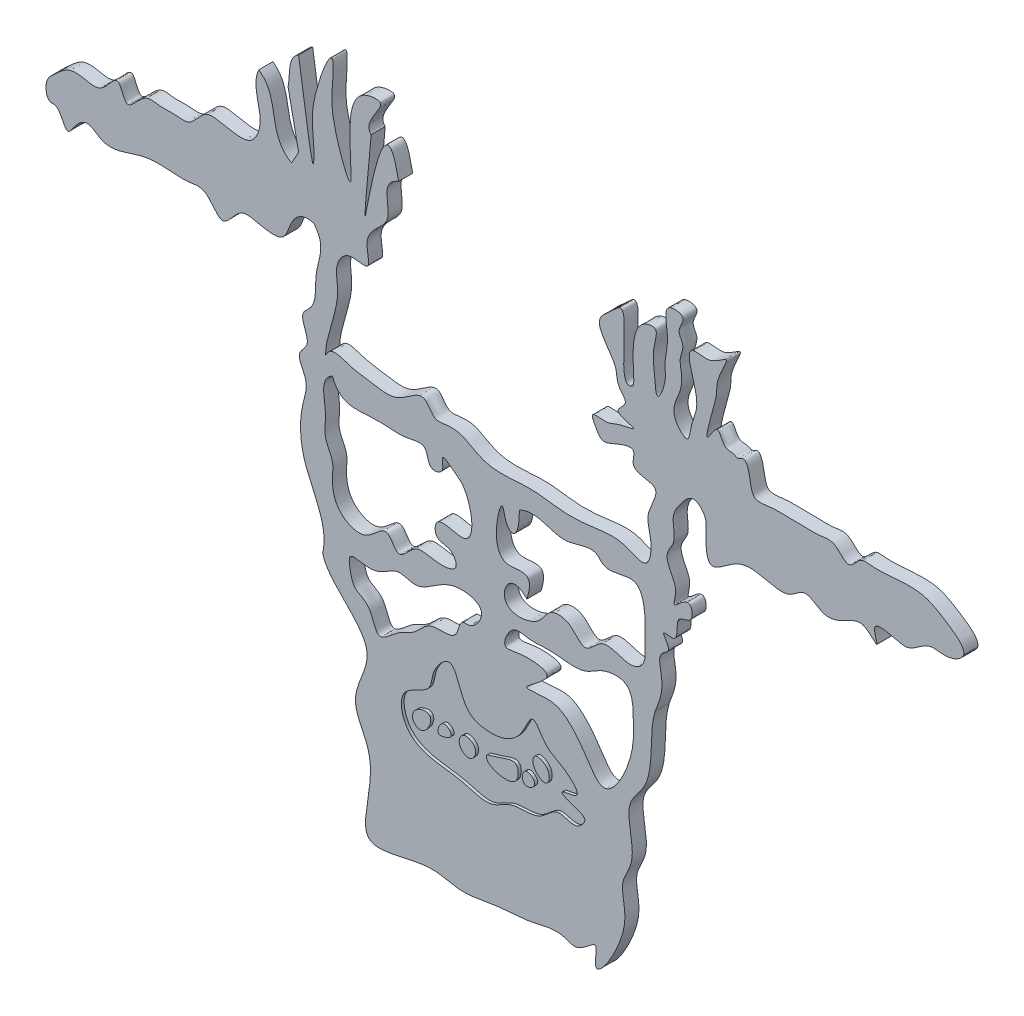
from build123d import *

# Parameters (mm, degrees)
BOSS_EXTRU_1_DEPTH           = 2.5
BOSS_EXTRU_1_DEPTH_BACK      = 2.5
ENL_V_MAT_EXTRU_1_DEPTH      = 1
ENL_V_MAT_EXTRU_1_DEPTH_BACK = 1
BOSS_EXTRU_2_START           = -5
BOSS_EXTRU_2_DEPTH           = 5.1
BOSS_EXTRU_2_2_DEPTH         = 5.1
BOSS_EXTRU_2_3_DEPTH         = 5.1
BOSS_EXTRU_2_4_DEPTH         = 5.1
BOSS_EXTRU_2_5_DEPTH         = 5.1
BOSS_EXTRU_2_6_DEPTH         = 5.1


with BuildPart() as part:
    # Esquisse5 → Boss.-Extru.1 (new, two sides: drawn at the far end of the back side and taken through both)
    with BuildSketch(Plane.XY.offset(-BOSS_EXTRU_1_DEPTH_BACK)):
        with BuildLine():
            add(Edge.make_bspline(
                [(-109.344511659, 25.153395268), (-107.589254649, 29.421911051), (-101.339219595, 25.902929652), (-92.695552544, 25.314220124), (-83.46448962, 22.676252114), (-74.412996642, 33.275492549), (-71.274904721, 24.700650474), (-66.452941292, 25.333481683), (-60.820445495, 25.847182966), (-54.304488593, 20.502930821), (-45.153016179, 19.865306079), (-34.913101969, 21.206550113), (-24.021566002, 18.621998763), (-12.651602755, 20.170931924), (-3.866471795, 21.215630898), (5.364616437, 15.647679976), (7.119848324, 26.697353477), (3.217301344, 33.405226344), (11.779222196, 45.092953011), (-1.968971541, 43.599367897), (1.437557426, 52.096278646), (-6.019987537, 50.088991806), (-11.052796945, 46.823583059), (-13.405767436, 51.113244464), (-15.699295799, 55.645390129), (-8.916615346, 53.947845827), (-5.980193523, 56.388562404), (4.10796492, 57.51216439), (-8.750760516, 59.217405885), (-0.961983774, 63.846560735), (-6.064668992, 67.643002906), (-5.676761926, 73.309467573), (-9.571336368, 78.077252265), (-13.834516264, 85.158128626), (-8.507672521, 88.825856235), (0.450211474, 98.200422591), (-6.965143511, 65.105364995), (0, 70.636018)],
                knots=[0, 0, 0, 0, 0.038715947, 0.066818348, 0.10588863, 0.146716867, 0.169739251, 0.177878893, 0.200669891, 0.234895126, 0.269428703, 0.305280107, 0.355981649, 0.398432828, 0.437537011, 0.464385494, 0.493232459, 0.529194573, 0.564336717, 0.596403188, 0.612682472, 0.632285326, 0.657557571, 0.673836855, 0.684132778, 0.703735632, 0.721045052, 0.742876924, 0.766185312, 0.78379405, 0.800554599, 0.820690961, 0.846940518, 0.873240506, 0.900963128, 0.913677655, 1, 1, 1, 1], degree=3))
            add(Edge.make_bspline(
                [(0, 70.636018), (0.805278353, 74.133831027), (-3.107450165, 91.518619561), (8.999346732, 92.505976238), (6.429898138, 84.358492656), (7.423975469, 80.33225472), (8.047696894, 68.486069297), (11.93858664, 77.708465744), (10.624327057, 83.920889427), (13.29432721, 91.236631904), (9.694077884, 102.364063289), (19.693091186, 100.976923321), (14.852165034, 95.702541646), (18.556549684, 91.733970901), (15.987726932, 87.363671228), (17.379094774, 82.557729252), (16.919550407, 75.862474876), (11.973387385, 69.60348445), (19.599849553, 61.660448674), (20.550098448, 70.678139802), (25.142121191, 76.975381446), (16.828251117, 92.381116223), (24.21426829, 92.082856929), (27.829551161, 91.182942151), (35.821054195, 98.230249078), (29.327432761, 88.125694168), (29.736434139, 82.411949115), (28.159368987, 77.404069448), (24.30367085, 62.947282181), (30.248138499, 74.915772772), (31.480824806, 68.575348807), (33.908397317, 67.391513918), (35.493450325, 67.749272121), (37.063599096, 66.387557293), (39.862305143, 69.019204089), (41.649690428, 62.398254073), (42.104131559, 56.237417085), (49.688197455, 58.008481319), (55.474079484, 57.437235744), (61.145043283, 57.694893692), (66.202600348, 57.337373933), (71.720457182, 59.093143593), (76.504564451, 50.820023685), (80.002047639, 58.06603763), (85.292941894, 57.307788307), (92.159539484, 57.557826638), (102.159758833, 58.777982772), (110.318718464, 54.217649231), (120.723019561, 47.020505934), (111.49153862, 41.878814117), (104.406812701, 44.603087065), (98.824803059, 37.906772926), (92.588714261, 39.26305939), (83.492400754, 41.67245803), (88.179812212, 31.367081894), (82.205743571, 38.915082929), (75.77616626, 36.65390107), (68.620618416, 31.604980211), (61.085256324, 39.393731836), (55.350460652, 32.684114008), (46.655915712, 34.489461218), (37.269088825, 36.887116093), (25.959282015, 24.617169038), (25.555414021, 37.329677127), (26.158045408, 43.180184066), (21.146621221, 48.057671533), (16.562027313, 42.601143935), (12.914768993, 37.099591197), (15.681239193, 30.051306943), (10.493520534, 24.535983476), (13.902430182, 18.951870966), (15.494449493, 14.848995948), (13.221286291, 7.817015965), (20.25002737, 16.854659461), (21.74484938, 7.330408273), (13.653478554, 8.32061916), (17.166253744, -1.609178359), (8.537056537, 1.233931252), (14.230464742, -4.47792894), (8.0837126, -7.0097751), (11.342317074, -16.176738627), (9.40657662, -21.600619943), (7.719657181, -25.69170208)],
                knots=[0, 0, 0, 0, 0.04512477, 0.049215334, 0.059032686, 0.077849279, 0.08959095, 0.101354273, 0.112840454, 0.130913155, 0.149078205, 0.15742135, 0.167540846, 0.174530804, 0.184483575, 0.192705506, 0.203372391, 0.223277932, 0.234284513, 0.242045812, 0.262102092, 0.290782748, 0.294055199, 0.302236326, 0.314315616, 0.330881136, 0.339103067, 0.350018052, 0.368971396, 0.378972163, 0.388474235, 0.390274787, 0.394744547, 0.397176959, 0.40095589, 0.411146586, 0.422652664, 0.434106242, 0.447196046, 0.459467737, 0.466830751, 0.477466216, 0.490401714, 0.502673405, 0.506763969, 0.520671885, 0.544397154, 0.561596989, 0.581299752, 0.593787701, 0.606877504, 0.623723476, 0.633574858, 0.647506816, 0.656653594, 0.66778113, 0.676003061, 0.696455879, 0.711496698, 0.722862283, 0.738406425, 0.759677356, 0.780901035, 0.799194592, 0.808230942, 0.818403335, 0.829190633, 0.841996123, 0.857540264, 0.866687043, 0.881184037, 0.888726664, 0.896134989, 0.907500575, 0.916647353, 0.925794131, 0.939899163, 0.946444065, 0.955636463, 0.961421394, 0.976170131, 1, 1, 1, 1], degree=3))
            add(Edge.make_bspline(
                [(7.719657181, -25.69170208), (5.860032138, -31.69384322), (7.080951882, -40.496405286), (4.106474287, -51.814433702), (-2.522861177, -57.97612198), (-0.921343648, -67.654446459), (0.340462906, -76.191049709), (-6.045232839, -85.947966736), (1.412338563, -96.208246256), (-15.655520027, -122.942088627), (-12.034068325, -104.623657721), (-19.237214543, -113.838420046), (-26.978302304, -109.481218495), (-35.998502741, -113.12173714), (-48.753037264, -113.068431299), (-60.380289889, -116.539272865), (-75.231159691, -111.422716989), (-96.82300832, -122.283473286), (-94.071317906, -101.530103463), (-91.86865944, -89.112488967), (-102.259421439, -74.620042773), (-86.758954073, -54.760298752), (-108.135680998, -44.578286089), (-110.355785067, -36.085667067)],
                knots=[0, 0, 0, 0, 0.06920362, 0.098548886, 0.128834178, 0.163223612, 0.200739359, 0.224548643, 0.282385419, 0.351323971, 0.371645, 0.400340732, 0.416281859, 0.46496608, 0.499497327, 0.562335425, 0.592403333, 0.681558062, 0.715947496, 0.784726365, 0.829733318, 0.894183896, 1, 1, 1, 1], degree=3))
            add(Edge.make_bspline(
                [(-110.355785067, -36.085667067), (-108.042293123, -26.360063991), (-118.326558085, -14.272605293), (-118.714425814, 3.66313205), (-114.860463566, 14.232484722), (-120.557913386, 20.862442365), (-113.3368001, 26.081796862), (-119.715204471, 33.322468523), (-111.973330244, 38.731786935), (-114.327664092, 50.538790764), (-108.873342939, 58.304984298), (-113.502097654, 63.818945018)],
                knots=[0, 0, 0, 0, 0.256249372, 0.424787405, 0.4974419, 0.568528933, 0.611921815, 0.700995419, 0.73798122, 0.848138002, 1, 1, 1, 1], degree=3))
            add(Edge.make_bspline(
                [(-113.502097654, 63.818945018), (-117.216919888, 64.974160053), (-121.748065172, 61.665236127), (-123.719157006, 51.476400884), (-132.731242731, 54.005842644), (-140.659773876, 55.261859504), (-145.939869408, 43.799871326), (-151.186142271, 56.015698227), (-157.61954259, 54.079305538), (-164.313623573, 54.337676903), (-172.456034576, 55.228155827), (-180.830885545, 51.617026849), (-188.498853616, 50.497174688), (-193.47625054, 55.536732812), (-197.997266421, 52.398763213), (-201.639988115, 45.173141483), (-203.377944906, 54.667104022), (-208.498005036, 53.929016864), (-209.28437311, 60.586477493), (-204.94376512, 64.079614419), (-200.835383527, 68.139512695), (-194.823566254, 67.694411052), (-188.39932055, 65.501258016), (-182.827030504, 76.736586869), (-180.076851833, 63.075179343), (-174.283673763, 74.188787303), (-167.784138476, 72.12556278), (-163.063980401, 72.85376943), (-156.392991236, 71.545988081), (-153.182052561, 79.315606266), (-144.520461557, 78.157439268), (-135.507868967, 75.465748345), (-130.464285347, 88.42193884), (-135.765529528, 95.148428863), (-133.042751829, 101.23721897)],
                knots=[0, 0, 0, 0, 0.042215846, 0.0715411, 0.118379145, 0.137114363, 0.1783744, 0.218206019, 0.244435324, 0.259423498, 0.310008586, 0.350926919, 0.382776789, 0.407912721, 0.429761552, 0.449677362, 0.484223396, 0.48797044, 0.515249329, 0.536610763, 0.566233744, 0.586842483, 0.61494531, 0.650934488, 0.676962284, 0.715947747, 0.738430008, 0.762785791, 0.781521009, 0.822781046, 0.843389785, 0.893974873, 0.924987177, 1, 1, 1, 1], degree=3))
            add(Edge.make_bspline(
                [(-133.042751829, 101.23721897), (-124.997894036, 95.609485937), (-130.542559368, 83.862724923), (-121.401511044, 78.370495999)],
                knots=[0, 0, 0, 0, 1, 1, 1, 1], degree=3))
            Line((-121.401511044, 78.370495999), (-118.906959447, 82.943840593))
            Line((-118.906959447, 82.943840593), (-122.648786842, 101.23721897))
            add(Edge.make_bspline(
                [(-118.906959447, 112.878459755), (-123.089001942, 110.369112423), (-121.742081518, 105.17006777), (-122.648786842, 101.23721897)],
                knots=[0, 0, 0, 0, 1, 1, 1, 1], degree=3))
            add(Edge.make_bspline(
                [(-118.906959447, 112.878459755), (-117.987046534, 108.864393082), (-113.417892248, 71.51089919), (-113.45093178, 91.338067865), (-115.671361183, 99.265896618), (-105.94631718, 124.811600551), (-106.900478172, 108.607284024), (-107.748689985, 99.377424054), (-97.836147782, 72.122907261), (-102.352170363, 100.972747778), (-98.231217436, 112.857815769), (-85.492652151, 113.502088933), (-96.578313927, 104.414511034), (-93.12992628, 101.23721897)],
                knots=[0, 0, 0, 0, 0.203681945, 0.231518554, 0.326163025, 0.443506797, 0.493612694, 0.552069573, 0.681472385, 0.803953465, 0.895136951, 0.917406239, 1, 1, 1, 1], degree=3))
            add(Edge.make_bspline(
                [(-93.12992628, 101.23721897), (-99.727046417, 29.646897087), (-90.513740123, 130.523044076), (-83.377237133, 91.741906078)],
                knots=[0, 0, 0, 0, 1, 1, 1, 1], degree=3))
            add(Edge.make_bspline(
                [(-83.377237133, 91.741906078), (-90.448707401, 89.033229159), (-82.145183217, 76.719013031), (-97.431119268, 71.278493512), (-92.061494489, 57.954654831), (-101.97590079, 61.839432085), (-106.26095686, 54.701365469), (-103.356986924, 42.618252852), (-109.290101236, 32.775190883), (-109.344511659, 25.153395268)],
                knots=[0, 0, 0, 0, 0.182686469, 0.350002825, 0.446213418, 0.524077948, 0.620688407, 0.695610259, 1, 1, 1, 1], degree=3))
        make_face()
        with BuildLine():
            add(Edge.make_bspline(
                [(-60.284996922, -22.658843671), (-57.679623036, -22.792823807), (-51.01424169, -24.694812643), (-56.521322114, -32.868158212), (-61.895337536, -31.940577147), (-62.02146133, -40.685562755), (-72.483746322, -37.086251409), (-77.168246521, -44.712504934), (-83.869496053, -46.348051791), (-91.474395334, -55.158490288), (-92.739744826, -43.492947687), (-99.51793155, -41.638568616), (-100.50397494, -36.88423617), (-101.550662107, -30.534858217), (-93.304949934, -33.435915706), (-88.39295956, -30.87212657), (-83.103943407, -27.526114356), (-76.652699656, -30.773754759), (-69.425165146, -24.957803693), (-64.053961827, -22.46502641), (-60.284996922, -22.658843671)],
                knots=[0, 0, 0, 0, 0.05860203, 0.128869378, 0.13940948, 0.186334695, 0.264119349, 0.327318135, 0.383462883, 0.450038592, 0.522701203, 0.565587317, 0.610698648, 0.642318954, 0.693500435, 0.757509471, 0.792112126, 0.841798644, 0.915225605, 1, 1, 1, 1], degree=3))
        make_face(mode=Mode.SUBTRACT)
        with BuildLine():
            add(Edge.make_bspline(
                [(-45.317687342, -32.343839672), (-46.54173064, -31.33391442), (-43.50546744, -24.106038911), (-36.48795409, -26.395680664), (-28.325720353, -24.920709339), (-18.331207252, -27.681729989), (-11.155234007, -21.696393611), (-0.218090155, -20.691342992), (0.023089394, -33.811646473), (0.250723748, -44.398951812), (-9.488304087, -63.953624722), (-17.298698285, -50.578847149), (-22.361645481, -44.295936677), (-28.897297122, -39.836964754), (-43.458060966, -43.227354147), (-24.101037263, -32.293001082), (-38.966002727, -31.32880479), (-44.686552491, -32.864572087), (-45.317687342, -32.343839672)],
                knots=[0, 0, 0, 0, 0.049950649, 0.081412473, 0.13861579, 0.224420765, 0.269572765, 0.329636248, 0.3984377, 0.47882395, 0.598799949, 0.659914582, 0.726618469, 0.773962638, 0.831165954, 0.898517798, 0.974244706, 1, 1, 1, 1], degree=3))
        make_face(mode=Mode.SUBTRACT)
        with BuildLine():
            add(Edge.make_bspline(
                [(-106.849960063, 20.164292074), (-104.4176376, 13.083024939), (-96.663714679, 14.445390232), (-87.075727019, 14.469465298), (-81.105270565, 13.673671294), (-72.792079958, 16.708316694), (-73.195335632, 8.218727754), (-64.499139676, 10.403170961), (-71.145847235, 18.672015819), (-61.94803132, 11.017602886)],
                knots=[0, 0, 0, 0, 0.29295692, 0.41008258, 0.535016616, 0.659950653, 0.764711027, 0.829986297, 1, 1, 1, 1], degree=3))
            add(Edge.make_bspline(
                [(-61.94803132, 11.017602886), (-58.00948764, 8.515751679), (-53.228955717, -12.652695636), (-70.441520781, -2.747845616), (-70.671887797, -12.241399063), (-64.676859457, -11.30445429), (-61.26749811, -18.21182153), (-70.868512549, -19.205270279), (-77.591907708, -16.019487697), (-83.479554547, -25.95513285), (-87.621513939, -14.836311931), (-93.599093926, -24.003349654), (-100.951674973, -23.240865934), (-106.494860397, -18.418599398), (-107.12332934, -11.884172144), (-106.310964788, -5.454637161), (-110.3922844, -0.147625415), (-108.205650297, 9.2489794), (-111.87637407, 17.393607833), (-106.849960063, 20.164292074)],
                knots=[0, 0, 0, 0, 0.141144413, 0.214347354, 0.24617472, 0.287550295, 0.319672821, 0.374752262, 0.435224257, 0.489982127, 0.532801468, 0.596764739, 0.643129709, 0.691471568, 0.753000383, 0.784827749, 0.837727281, 0.890242435, 1, 1, 1, 1], degree=3))
        make_face(mode=Mode.SUBTRACT)
        with BuildLine():
            add(Edge.make_bspline(
                [(-37.834032551, -13.927913082), (-34.37077832, -3.013999217), (-45.44980997, -10.161057876), (-50.025710131, 0.026726855), (-46.605690254, 14.117852844), (-45.17878683, 2.980235903), (-40.494724718, 1.638182997), (-40.475695383, 12.108204048)],
                knots=[0, 0, 0, 0, 0.291807796, 0.452467098, 0.68092251, 0.763865725, 1, 1, 1, 1], degree=3))
            add(Edge.make_bspline(
                [(-40.475695383, 12.108204048), (-33.864389084, 15.400301842), (-26.44818834, 7.161777526), (-14.396399814, 14.572909383), (-9.766577735, 8.480621443), (-4.631433883, 10.550994115), (3.214257025, 11.014558921), (4.429735975, 0.983080079), (3.965250126, -6.470122581), (4.654603651, -13.382879079), (-2.543331551, -17.411606933), (-10.397698797, -10.5220015), (-17.3151872, -21.672354484), (-22.185238624, -12.699371365), (-30.370894003, -12.915408516), (-33.425703048, -20.945833936), (-50.379770922, -22.250174577), (-43.826459571, -7.823907389), (-37.834032551, -13.927913082)],
                knots=[0, 0, 0, 0, 0.130404059, 0.2124579, 0.225807884, 0.291886928, 0.310766655, 0.396954786, 0.445727415, 0.503147863, 0.528516734, 0.613998334, 0.668134851, 0.726665389, 0.773864706, 0.820642593, 0.908747986, 1, 1, 1, 1], degree=3))
        make_face(mode=Mode.SUBTRACT)
    extrude(amount=BOSS_EXTRU_1_DEPTH + BOSS_EXTRU_1_DEPTH_BACK)

    # Esquisse10 → Enlèv. mat.-Extru.1 (cut, two sides: drawn at the far end of the back side and taken through both)
    with BuildSketch(Plane.XY.offset(2.5).offset(-ENL_V_MAT_EXTRU_1_DEPTH_BACK)):
        with BuildLine():
            add(Edge.make_bspline(
                [(-65.540202069, -47.181767732), (-62.526796985, -47.071111185), (-61.52574011, -59.141409508), (-50.035726383, -62.48750703), (-40.117270713, -60.050430258), (-35.98622805, -46.66420919), (-30.851025415, -57.350925543), (-25.472405134, -57.990286094), (-16.759212756, -66.616073943), (-27.395934416, -66.286829993), (-21.563656228, -69.663767975), (-15.269988521, -70.268358789), (-20.667539453, -76.695651704), (-27.246819692, -71.81142614), (-33.305923924, -80.79365559), (-42.931221115, -78.280931835), (-50.931476969, -85.10579532), (-60.443106924, -81.07201438), (-70.479488589, -80.494448983), (-81.453706377, -77.157128652), (-84.260850793, -62.320698999), (-71.463667508, -60.658646864), (-71.708217877, -52.157077082), (-67.307492214, -47.246665156), (-65.540202069, -47.181767732)],
                knots=[0, 0, 0, 0, 0.074168918, 0.111192732, 0.189974926, 0.228193362, 0.264295277, 0.316050521, 0.351333977, 0.380168788, 0.395456162, 0.431495778, 0.454031447, 0.490319615, 0.533245886, 0.593544245, 0.633375005, 0.691239127, 0.744912668, 0.806538045, 0.866237151, 0.925634363, 0.9565017, 1, 1, 1, 1], degree=3))
        make_face()
    extrude(amount=ENL_V_MAT_EXTRU_1_DEPTH + ENL_V_MAT_EXTRU_1_DEPTH_BACK, mode=Mode.SUBTRACT)


with BuildPart() as body_2:
    # Esquisse11 → Boss.-Extru.2 (new body)
    with BuildSketch(Plane.XY.offset(2.5).offset(BOSS_EXTRU_2_START)):
        with BuildLine():
            add(Edge.make_bspline(
                [(-76.245326856, -66.969623898), (-77.802567924, -67.831028734), (-79.472356869, -70.822802051), (-74.177980324, -74.991654568), (-69.766564586, -65.910456933), (-74.852488101, -66.199159991), (-76.245326856, -66.969623898)],
                knots=[0, 0, 0, 0, 0.238984672, 0.42286315, 0.786245611, 1, 1, 1, 1], degree=3))
        make_face()
    extrude(amount=BOSS_EXTRU_2_DEPTH)


with BuildPart() as body_3:
    # Esquisse11 → Boss.-Extru.2 2 (new body)
    with BuildSketch(Plane.XY.offset(2.5).offset(BOSS_EXTRU_2_START)):
        with BuildLine():
            add(Edge.make_bspline(
                [(-67.268342332, -70.973237046), (-65.977321978, -70.65641324), (-63.196737709, -69.477868466), (-67.934125699, -64.913780505), (-70.320431364, -71.483139871), (-67.952058925, -71.141025023), (-67.268342332, -70.973237046)],
                knots=[0, 0, 0, 0, 0.253700463, 0.52358501, 0.865641765, 1, 1, 1, 1], degree=3))
        make_face()
    extrude(amount=BOSS_EXTRU_2_2_DEPTH)


with BuildPart() as body_4:
    # Esquisse11 → Boss.-Extru.2 3 (new body)
    with BuildSketch(Plane.XY.offset(2.5).offset(BOSS_EXTRU_2_START)):
        with BuildLine():
            add(Edge.make_bspline(
                [(-60.238166289, -66.969623898), (-61.04121235, -67.328429972), (-61.972053831, -68.890537635), (-61.532843882, -71.737173155), (-57.547786594, -74.456888085), (-54.508458701, -68.506563709), (-58.804015947, -66.328836429), (-60.238166289, -66.969623898)],
                knots=[0, 0, 0, 0, 0.150740819, 0.256618737, 0.486382243, 0.730793778, 1, 1, 1, 1], degree=3))
        make_face()
    extrude(amount=BOSS_EXTRU_2_3_DEPTH)


with BuildPart() as body_5:
    # Esquisse11 → Boss.-Extru.2 4 (new body)
    with BuildSketch(Plane.XY.offset(2.5).offset(BOSS_EXTRU_2_START)):
        with BuildLine():
            add(Edge.make_bspline(
                [(-52.078214522, -69.142857233), (-52.167254345, -69.619718107), (-51.751524987, -71.714253166), (-44.597732881, -73.837497751), (-40.609996902, -71.453739055), (-40.789610051, -64.034859442), (-46.705472605, -67.647106657), (-51.970973665, -68.688415671), (-52.070174083, -69.099795932), (-52.078214522, -69.142857233)],
                knots=[0, 0, 0, 0, 0.106461708, 0.312869244, 0.450857916, 0.59623707, 0.903863372, 0.990386337, 1, 1, 1, 1], degree=3))
        make_face()
    extrude(amount=BOSS_EXTRU_2_4_DEPTH)


with BuildPart() as body_6:
    # Esquisse11 → Boss.-Extru.2 5 (new body)
    with BuildSketch(Plane.XY.offset(2.5).offset(BOSS_EXTRU_2_START)):
        with BuildLine():
            add(Edge.make_bspline(
                [(-38.197614369, -66.969623898), (-39.393578854, -67.492563419), (-39.925213234, -71.726458777), (-36.024621604, -71.411744565), (-33.996702039, -68.608803811), (-37.046267933, -66.46619377), (-38.197614369, -66.969623898)],
                knots=[0, 0, 0, 0, 0.317087266, 0.525661912, 0.694742362, 1, 1, 1, 1], degree=3))
        make_face()
    extrude(amount=BOSS_EXTRU_2_5_DEPTH)


with BuildPart() as body_7:
    # Esquisse11 → Boss.-Extru.2 6 (new body)
    with BuildSketch(Plane.XY.offset(2.5).offset(BOSS_EXTRU_2_START)):
        with BuildLine():
            add(Edge.make_bspline(
                [(-34.967533484, -60.782647884), (-35.532279468, -61.268966156), (-36.24519506, -64.670544204), (-30.231681205, -69.324100688), (-29.066309187, -61.889041623), (-33.811387796, -59.787059089), (-34.967533484, -60.782647884)],
                knots=[0, 0, 0, 0, 0.141483612, 0.479773027, 0.710355324, 1, 1, 1, 1], degree=3))
        make_face()
    extrude(amount=BOSS_EXTRU_2_6_DEPTH)


solid = Compound([part.part, body_2.part, body_3.part, body_4.part, body_5.part, body_6.part, body_7.part])
